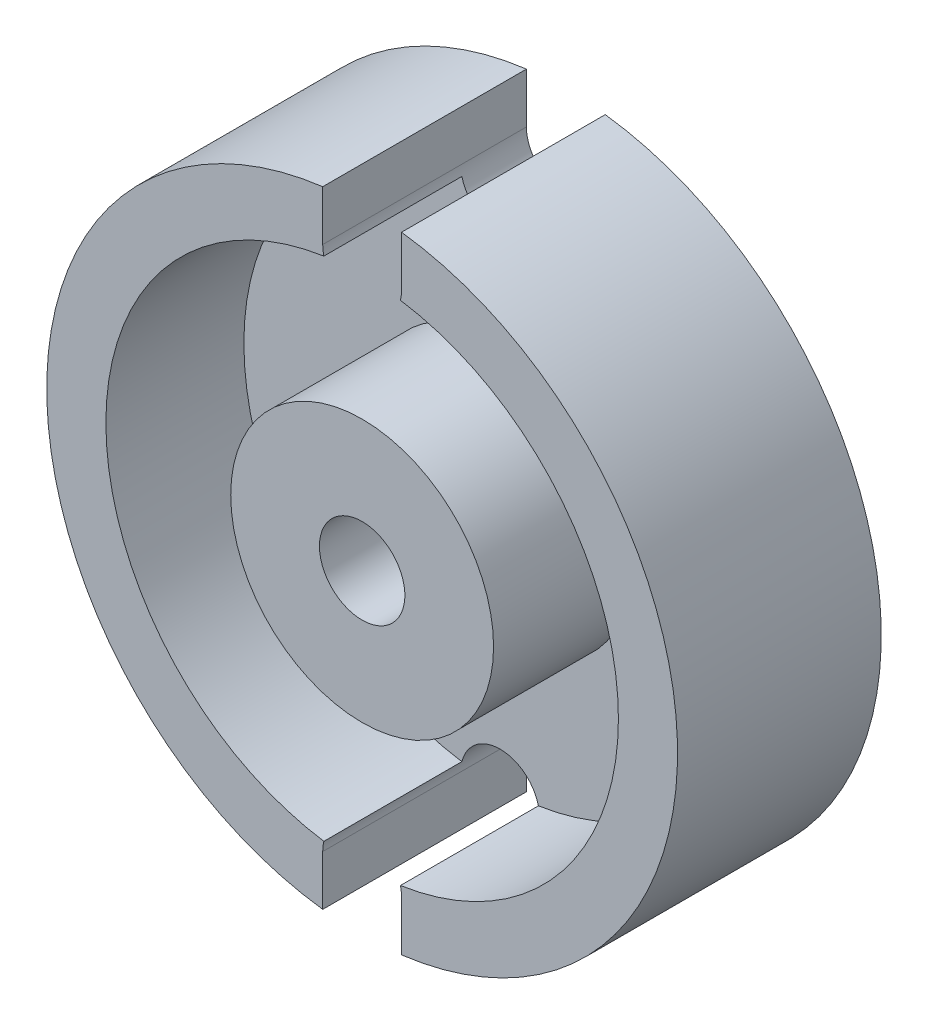
from build123d import *

# Parameters (mm, degrees)
SKETCH_1_R          = 24
SKETCH_1_R_2        = 3.25
EXTRUDE_1_DEPTH     = 15.5
SKETCH_2_R          = 19.5
SKETCH_2_R_2        = 10
CUT_EXTRUDE_1_DEPTH = 10.5
CUT_EXTRUDE_2_DEPTH = 20


with BuildPart() as part:
    # Эскиз1 → Вытянуть1 (new body)
    with BuildSketch(Plane.XY):
        Circle(SKETCH_1_R)
        with Locations(Location((0, 0, 0), (0, 0, 180))):
            Circle(SKETCH_1_R_2, mode=Mode.SUBTRACT)
    extrude(amount=EXTRUDE_1_DEPTH)

    # Эскиз2 → Вырез-Вытянуть1 (cut)
    with BuildSketch(Plane.XY.offset(15.5)):
        Circle(SKETCH_2_R)
        Circle(SKETCH_2_R_2, mode=Mode.SUBTRACT)
    extrude(amount=-CUT_EXTRUDE_1_DEPTH, mode=Mode.SUBTRACT)

    # Эскиз3 → Вырез-Вытянуть2 (cut)
    with BuildSketch(Plane(origin=(0, 0, 0), x_dir=(-1, 0, 0), z_dir=(0, 0, -1))):
        with BuildLine():
            Line((3, 20), (3, 23.8117618))
            ThreePointArc((3, 23.8117618), (0, 24), (-3, 23.8117618))
            Line((-3, 23.8117618), (-3, 20))
            ThreePointArc((-3, 20), (0, 17), (3, 20))
        make_face()
        with BuildLine():
            Line((3, -20), (3, -23.8117618))
            ThreePointArc((3, -23.8117618), (0, -24), (-3, -23.8117618))
            Line((-3, -23.8117618), (-3, -20))
            ThreePointArc((-3, -20), (0, -17), (3, -20))
        make_face()
    extrude(amount=-CUT_EXTRUDE_2_DEPTH, mode=Mode.SUBTRACT)


solid = part.part
